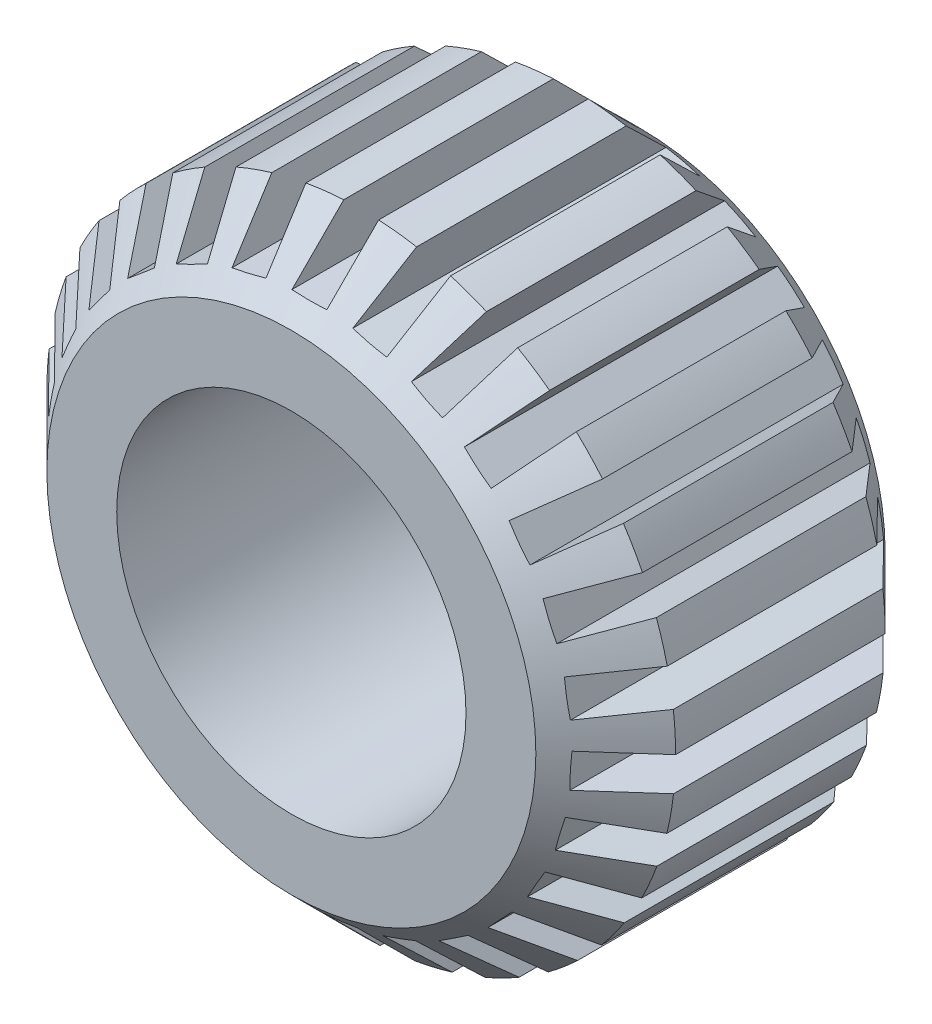
from build123d import *

# Parameters (mm, degrees)
SKETCH1_R           = 9
SKETCH1_R_2         = 5
BOSS_EXTRUDE1_DEPTH = 10
CHAMFER1_SIZE       = 2
CUT_EXTRUDE1_DEPTH  = 17.186414056
CIRPATTERN1_COUNT   = 27


with BuildPart() as part:
    # Sketch1 → Boss-Extrude1 (new body)
    with BuildSketch(Plane.XY):
        Circle(SKETCH1_R)
        Circle(SKETCH1_R_2, mode=Mode.SUBTRACT)
    extrude(amount=-BOSS_EXTRUDE1_DEPTH)

    # Chamfer1
    chamfer1_edges = [part.edges().sort_by_distance(p)[0] for p in [
        (-9, 0, 0),
        (-9, 0, -10),
    ]]
    chamfer(chamfer1_edges, length=CHAMFER1_SIZE)

    # Sketch2 → Cut-Extrude1 (cut, through all)
    with BuildSketch(Plane.XY):
        with BuildLine():
            Line((-0.5, 7.5), (0.5, 7.5))
            Line((0.5, 7.5), (0.5, 8.986100378))
            ThreePointArc((0.5, 8.986100378), (0, 9), (-0.5, 8.986100378))
            Line((-0.5, 8.986100378), (-0.5, 7.5))
        make_face()
    cut_extrude1 = extrude(amount=-CUT_EXTRUDE1_DEPTH, mode=Mode.SUBTRACT)

    # CirPattern1: Cut-Extrude1 ×27 about axis
    cirpattern1_axis = Axis((0, 0, 0), (0, 0, 1))
    for i in range(1, CIRPATTERN1_COUNT):
        add(cut_extrude1.rotate(cirpattern1_axis, i * 360 / CIRPATTERN1_COUNT), mode=Mode.SUBTRACT)


solid = part.part
